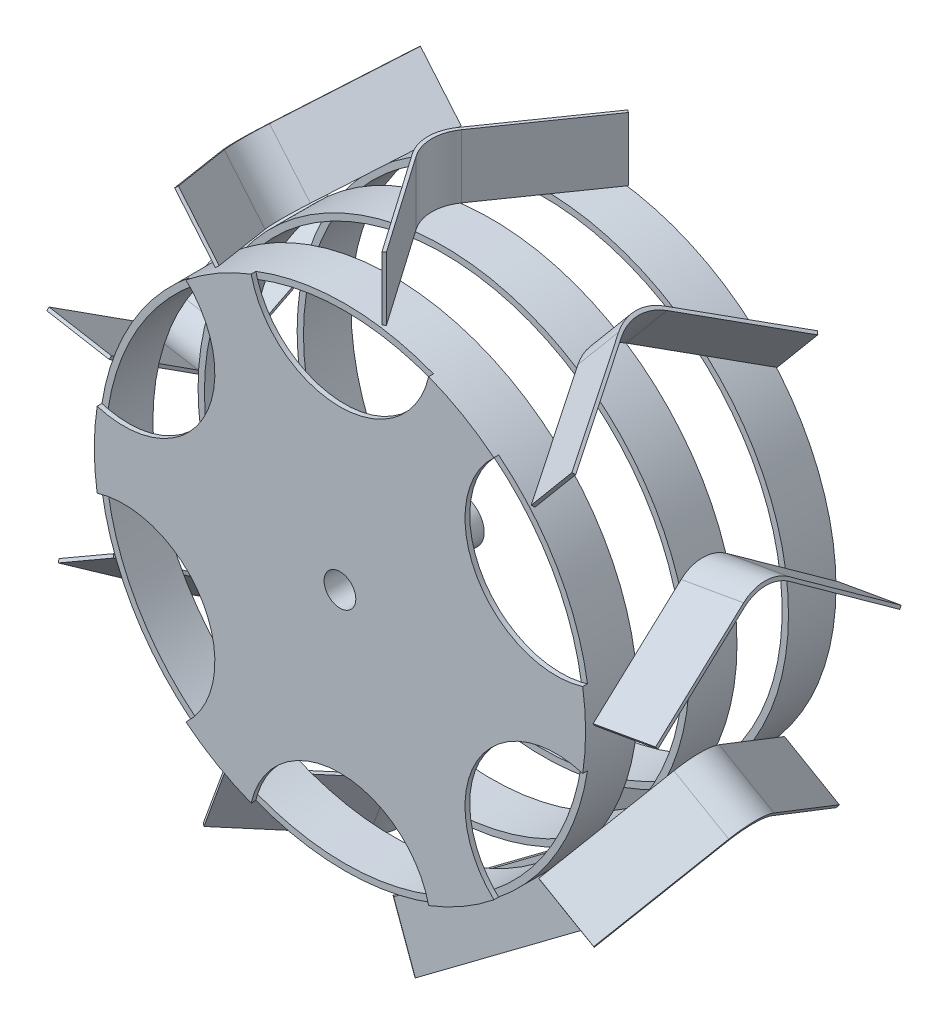
from build123d import *
from build123d.topology import SkipClean

# Parameters (mm, degrees)
EXTRUDE_1_DEPTH                 = 3
SKETCH_2_R                      = 14
CUT_EXTRUDE_1_DEPTH             = 3
EXTRUDE_2_DEPTH                 = 74
EXTRUDE_2_DEPTH_BACK            = 3
SKETCH_2_4_R                    = 14
SKETCH_2_4_R_2                  = 10
CUT_EXTRUDE_2_REACH             = 227.48
SKETCH_4_R                      = 4
CUT_EXTRUDE_2_DIRECTION_2_REACH = 227.48
SKETCH_5_R                      = 155
SKETCH_5_R_2                    = 151
EXTRUDE_3_DEPTH                 = 30
EXTRUDE_4_DEPTH                 = 15
EXTRUDE_4_DEPTH_BACK            = 15
SKETCH_7_R                      = 155
SKETCH_7_R_2                    = 151
SKETCH_6_R                      = 155
SKETCH_6_R_2                    = 151
EXTRUDE_5_DEPTH                 = 30
EXTRUDE_6_DEPTH                 = 40
PATTERN_CIRCULAR_5_COUNT        = 9


with BuildPart() as part:
    # Эскиз1 → Бобышка-Вытянуть1 (new body)
    with BuildSketch(Plane.XY):
        with BuildLine():
            ThreePointArc((-56.016680379, 144.523809524), (-77.5, 134.233937587), (-97.15295031, 120.773773006))
            ThreePointArc((-97.15295031, 120.773773006), (-86.602540378, 50), (-153.169630689, 23.750036518))
            ThreePointArc((-153.169630689, 23.750036518), (-155, 0), (-153.169630689, -23.750036518))
            ThreePointArc((-153.169630689, -23.750036518), (-86.602540378, -50), (-97.15295031, -120.773773006))
            ThreePointArc((-97.15295031, -120.773773006), (-77.5, -134.233937587), (-56.016680379, -144.523809524))
            ThreePointArc((-56.016680379, -144.523809524), (0, -100), (56.016680379, -144.523809524))
            ThreePointArc((56.016680379, -144.523809524), (77.5, -134.233937587), (97.15295031, -120.773773006))
            ThreePointArc((97.15295031, -120.773773006), (86.602540378, -50), (153.169630689, -23.750036518))
            ThreePointArc((153.169630689, -23.750036518), (155, 0), (153.169630689, 23.750036518))
            ThreePointArc((153.169630689, 23.750036518), (86.602540378, 50), (97.15295031, 120.773773006))
            ThreePointArc((97.15295031, 120.773773006), (77.5, 134.233937587), (56.016680379, 144.523809524))
            ThreePointArc((56.016680379, 144.523809524), (0, 100), (-56.016680379, 144.523809524))
        make_face()
    extrude(amount=-EXTRUDE_1_DEPTH)

    # Эскиз2 → Вырез-Вытянуть1 (cut)
    with BuildSketch(Plane(origin=(0, 0, -3), x_dir=(-1, 0, 0), z_dir=(0, 0, -1))):
        Circle(SKETCH_2_R)
    extrude(amount=-CUT_EXTRUDE_1_DEPTH, mode=Mode.SUBTRACT)

    # Эскиз2<4> → Бобышка-Вытянуть2 (add, two sides: drawn at the far end of the back side and taken through both)
    with BuildSketch(Plane(origin=(0, 0, -3), x_dir=(-1, 0, 0), z_dir=(0, 0, -1)).offset(-EXTRUDE_2_DEPTH_BACK)):
        Circle(SKETCH_2_4_R)
        Circle(SKETCH_2_4_R_2, mode=Mode.SUBTRACT)
    extrude(amount=EXTRUDE_2_DEPTH + EXTRUDE_2_DEPTH_BACK)

    # Эскиз4 → Вырез-Вытянуть2 (cut, up to next)
    with BuildSketch(Plane(origin=(0, 0, 0), x_dir=(1, 0, 0), z_dir=(0, 1, 0)), mode=Mode.PRIVATE) as cut_extrude_2_sk1:
        with Locations((0, 56.5)):
            Circle(SKETCH_4_R)
    cut_extrude_2_tool1 = extrude(cut_extrude_2_sk1.sketch, amount=-CUT_EXTRUDE_2_REACH, mode=Mode.PRIVATE) & part.part
    add(cut_extrude_2_tool1.solids().sort_by_distance((0, 0, -56.5))[0], mode=Mode.SUBTRACT)

    # Эскиз4 → Вырез-Вытянуть2 direction 2 (cut, up to next)
    with BuildSketch(Plane(origin=(0, 0, 0), x_dir=(1, 0, 0), z_dir=(0, 1, 0)), mode=Mode.PRIVATE) as cut_extrude_2_direction_2_sk1:
        with Locations((0, 56.5)):
            Circle(SKETCH_4_R)
    cut_extrude_2_direction_2_tool1 = extrude(cut_extrude_2_direction_2_sk1.sketch, amount=CUT_EXTRUDE_2_DIRECTION_2_REACH, mode=Mode.PRIVATE) & part.part
    add(cut_extrude_2_direction_2_tool1.solids().sort_by_distance((0, 0, -56.5))[0], mode=Mode.SUBTRACT)

    # Эскиз5 → Бобышка-Вытянуть3 (add)
    with SkipClean():  # the faces are left unmerged after this step: merging them gives an invalid solid
        with BuildSketch(Plane(origin=(0, 0, -3), x_dir=(-1, 0, 0), z_dir=(0, 0, -1))):
            Circle(SKETCH_5_R)
            Circle(SKETCH_5_R_2, mode=Mode.SUBTRACT)
        extrude(amount=EXTRUDE_3_DEPTH)


with BuildPart() as body_2:
    # Эскиз7 → Бобышка-Вытянуть4 (new, two sides: drawn at the far end of the back side and taken through both)
    with BuildSketch(Plane(origin=(0, 0, -80.5), x_dir=(-1, 0, 0), z_dir=(0, 0, -1)).offset(-EXTRUDE_4_DEPTH_BACK)):
        Circle(SKETCH_7_R)
        Circle(SKETCH_7_R_2, mode=Mode.SUBTRACT)
    extrude(amount=EXTRUDE_4_DEPTH + EXTRUDE_4_DEPTH_BACK)


with BuildPart() as body_3:
    # Эскиз6 → Бобышка-Вытянуть5 (new body)
    with BuildSketch(Plane(origin=(0, 0, -128), x_dir=(-1, 0, 0), z_dir=(0, 0, -1))):
        Circle(SKETCH_6_R)
        Circle(SKETCH_6_R_2, mode=Mode.SUBTRACT)
    extrude(amount=EXTRUDE_5_DEPTH)


with BuildPart() as body_4:
    # Эскиз9 → Бобышка-Вытянуть6 (new body)
    with BuildSketch(Plane(origin=(0, 155, 0), x_dir=(1, 0, 0), z_dir=(0, 1, 0))):
        with BuildLine():
            Line((23.529786299, 158), (-20.511835136, 94.792117385))
            ThreePointArc((-20.511835136, 94.792117385), (-25, 80.5), (-20.511835136, 66.207882615))
            Line((-20.511835136, 66.207882615), (23.529786299, 3))
            Line((23.529786299, 3), (25.17073311, 4.143369391))
            Line((25.17073311, 4.143369391), (-18.07421804, 66.207882615))
            ThreePointArc((-18.07421804, 66.207882615), (-22.562382904, 80.5), (-18.07421804, 94.792117385))
            Line((-18.07421804, 94.792117385), (25.17073311, 156.856630609))
            Line((25.17073311, 156.856630609), (23.529786299, 158))
        make_face()
    extrude(amount=EXTRUDE_6_DEPTH)


with BuildPart() as pattern_circular_5_1:
    # Круговой массив5: pattern copy
    add(body_4.part.rotate(Axis((0, 0, 0), (0, 0, -1)), 1 * 360 / PATTERN_CIRCULAR_5_COUNT))


with BuildPart() as pattern_circular_5_2:
    # Круговой массив5: pattern copy
    add(body_4.part.rotate(Axis((0, 0, 0), (0, 0, -1)), 2 * 360 / PATTERN_CIRCULAR_5_COUNT))


with BuildPart() as pattern_circular_5_3:
    # Круговой массив5: pattern copy
    add(body_4.part.rotate(Axis((0, 0, 0), (0, 0, -1)), 3 * 360 / PATTERN_CIRCULAR_5_COUNT))


with BuildPart() as pattern_circular_5_4:
    # Круговой массив5: pattern copy
    add(body_4.part.rotate(Axis((0, 0, 0), (0, 0, -1)), 4 * 360 / PATTERN_CIRCULAR_5_COUNT))


with BuildPart() as pattern_circular_5_5:
    # Круговой массив5: pattern copy
    add(body_4.part.rotate(Axis((0, 0, 0), (0, 0, -1)), 5 * 360 / PATTERN_CIRCULAR_5_COUNT))


with BuildPart() as pattern_circular_5_6:
    # Круговой массив5: pattern copy
    add(body_4.part.rotate(Axis((0, 0, 0), (0, 0, -1)), 6 * 360 / PATTERN_CIRCULAR_5_COUNT))


with BuildPart() as pattern_circular_5_7:
    # Круговой массив5: pattern copy
    add(body_4.part.rotate(Axis((0, 0, 0), (0, 0, -1)), 7 * 360 / PATTERN_CIRCULAR_5_COUNT))


with BuildPart() as pattern_circular_5_8:
    # Круговой массив5: pattern copy
    add(body_4.part.rotate(Axis((0, 0, 0), (0, 0, -1)), 8 * 360 / PATTERN_CIRCULAR_5_COUNT))


solid = Compound([part.part, body_2.part, body_3.part, body_4.part, pattern_circular_5_1.part, pattern_circular_5_2.part, pattern_circular_5_3.part, pattern_circular_5_4.part, pattern_circular_5_5.part, pattern_circular_5_6.part, pattern_circular_5_7.part, pattern_circular_5_8.part])
